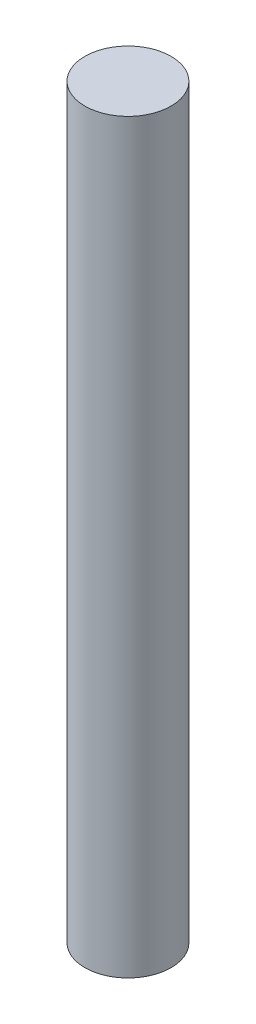
from build123d import *

# Parameters (mm, degrees)
SKETCH1_R           = 1.45
BOSS_EXTRUDE1_DEPTH = 25.1


with BuildPart() as part:
    # Sketch1 → Boss-Extrude1 (new body)
    with BuildSketch(Plane(origin=(0, 0, 0), x_dir=(1, 0, 0), z_dir=(0, 1, 0))):
        with Locations(Location((0, 0, 0), (0, 0, 270))):
            Circle(SKETCH1_R)
    extrude(amount=BOSS_EXTRUDE1_DEPTH)


solid = part.part
